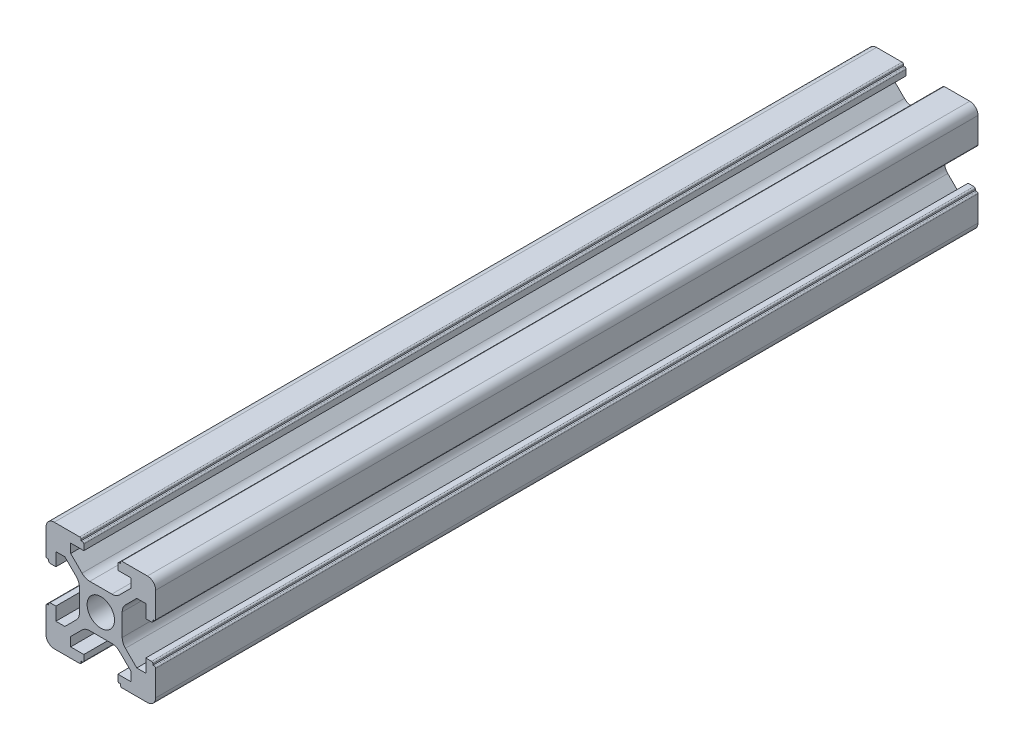
from build123d import *

# Parameters (mm, degrees)
SKETCH1_R           = 2.5
BOSS_EXTRUDE1_DEPTH = 150


with BuildPart() as part:
    # Sketch1 → Boss-Extrude1 (new body)
    with BuildSketch(Plane.XY):
        with BuildLine():
            Line((-8.5, 10), (-3.85, 10))
            ThreePointArc((-3.85, 10), (-3.673223305, 9.926776695), (-3.6, 9.75))
            Line((-3.6, 9.75), (-3.6, 9.5))
            Line((-3.6, 9.5), (-3.35, 9.5))
            ThreePointArc((-3.35, 9.5), (-3.173223305, 9.426776695), (-3.1, 9.25))
            Line((-3.1, 9.25), (-3.1, 8.2))
            Line((-3.1, 8.2), (-5.5, 8.2))
            Line((-5.5, 8.2), (-5.5, 6.560660172))
            Line((-5.5, 6.560660172), (-3.425126266, 4.485786438))
            ThreePointArc((-3.425126266, 4.485786438), (-2.776279568, 4.052240935), (-2.010912703, 3.9))
            Line((-2.010912703, 3.9), (2.010912703, 3.9))
            ThreePointArc((2.010912703, 3.9), (2.776279568, 4.052240935), (3.425126266, 4.485786438))
            Line((3.425126266, 4.485786438), (5.5, 6.560660172))
            Line((5.5, 6.560660172), (5.5, 8.2))
            Line((5.5, 8.2), (3.1, 8.2))
            Line((3.1, 8.2), (3.1, 9.25))
            ThreePointArc((3.1, 9.25), (3.173223305, 9.426776695), (3.35, 9.5))
            Line((3.35, 9.5), (3.6, 9.5))
            Line((3.6, 9.5), (3.6, 9.75))
            ThreePointArc((3.6, 9.75), (3.673223305, 9.926776695), (3.85, 10))
            Line((3.85, 10), (8.5, 10))
            ThreePointArc((8.5, 10), (9.560660172, 9.560660172), (10, 8.5))
            Line((10, 8.5), (10, 3.85))
            ThreePointArc((10, 3.85), (9.926776695, 3.673223305), (9.75, 3.6))
            Line((9.75, 3.6), (9.5, 3.6))
            Line((9.5, 3.6), (9.5, 3.35))
            ThreePointArc((9.5, 3.35), (9.426776695, 3.173223305), (9.25, 3.1))
            Line((9.25, 3.1), (8.2, 3.1))
            Line((8.2, 3.1), (8.2, 5.5))
            Line((8.2, 5.5), (6.560660172, 5.5))
            Line((6.560660172, 5.5), (4.485786438, 3.425126266))
            ThreePointArc((4.485786438, 3.425126266), (4.052240935, 2.776279568), (3.9, 2.010912703))
            Line((3.9, 2.010912703), (3.9, -2.010912703))
            ThreePointArc((3.9, -2.010912703), (4.052240935, -2.776279568), (4.485786438, -3.425126266))
            Line((4.485786438, -3.425126266), (6.560660172, -5.5))
            Line((6.560660172, -5.5), (8.2, -5.5))
            Line((8.2, -5.5), (8.2, -3.1))
            Line((8.2, -3.1), (9.25, -3.1))
            ThreePointArc((9.25, -3.1), (9.426776695, -3.173223305), (9.5, -3.35))
            Line((9.5, -3.35), (9.5, -3.6))
            Line((9.5, -3.6), (9.75, -3.6))
            ThreePointArc((9.75, -3.6), (9.926776695, -3.673223305), (10, -3.85))
            Line((10, -3.85), (10, -8.5))
            ThreePointArc((10, -8.5), (9.560660172, -9.560660172), (8.5, -10))
            Line((8.5, -10), (3.85, -10))
            ThreePointArc((3.85, -10), (3.673223305, -9.926776695), (3.6, -9.75))
            Line((3.6, -9.75), (3.6, -9.5))
            Line((3.6, -9.5), (3.35, -9.5))
            ThreePointArc((3.35, -9.5), (3.173223305, -9.426776695), (3.1, -9.25))
            Line((3.1, -9.25), (3.1, -8.2))
            Line((3.1, -8.2), (5.5, -8.2))
            Line((5.5, -8.2), (5.5, -6.560660172))
            Line((5.5, -6.560660172), (3.425126266, -4.485786438))
            ThreePointArc((3.425126266, -4.485786438), (2.776279568, -4.052240935), (2.010912703, -3.9))
            Line((2.010912703, -3.9), (-2.010912703, -3.9))
            ThreePointArc((-2.010912703, -3.9), (-2.776279568, -4.052240935), (-3.425126266, -4.485786438))
            Line((-3.425126266, -4.485786438), (-5.5, -6.560660172))
            Line((-5.5, -6.560660172), (-5.5, -8.2))
            Line((-5.5, -8.2), (-3.1, -8.2))
            Line((-3.1, -8.2), (-3.1, -9.25))
            ThreePointArc((-3.1, -9.25), (-3.173223305, -9.426776695), (-3.35, -9.5))
            Line((-3.35, -9.5), (-3.6, -9.5))
            Line((-3.6, -9.5), (-3.6, -9.75))
            ThreePointArc((-3.6, -9.75), (-3.673223305, -9.926776695), (-3.85, -10))
            Line((-3.85, -10), (-8.5, -10))
            ThreePointArc((-8.5, -10), (-9.560660172, -9.560660172), (-10, -8.5))
            Line((-10, -8.5), (-10, -3.85))
            ThreePointArc((-10, -3.85), (-9.926776695, -3.673223305), (-9.75, -3.6))
            Line((-9.75, -3.6), (-9.5, -3.6))
            Line((-9.5, -3.6), (-9.5, -3.35))
            ThreePointArc((-9.5, -3.35), (-9.426776695, -3.173223305), (-9.25, -3.1))
            Line((-9.25, -3.1), (-8.2, -3.1))
            Line((-8.2, -3.1), (-8.2, -5.5))
            Line((-8.2, -5.5), (-6.560660172, -5.5))
            Line((-6.560660172, -5.5), (-4.485786438, -3.425126266))
            ThreePointArc((-4.485786438, -3.425126266), (-4.052240935, -2.776279568), (-3.9, -2.010912703))
            Line((-3.9, -2.010912703), (-3.9, 2.010912703))
            ThreePointArc((-3.9, 2.010912703), (-4.052240935, 2.776279568), (-4.485786438, 3.425126266))
            Line((-4.485786438, 3.425126266), (-6.560660172, 5.5))
            Line((-6.560660172, 5.5), (-8.2, 5.5))
            Line((-8.2, 5.5), (-8.2, 3.1))
            Line((-8.2, 3.1), (-9.25, 3.1))
            ThreePointArc((-9.25, 3.1), (-9.426776695, 3.173223305), (-9.5, 3.35))
            Line((-9.5, 3.35), (-9.5, 3.6))
            Line((-9.5, 3.6), (-9.75, 3.6))
            ThreePointArc((-9.75, 3.6), (-9.926776695, 3.673223305), (-10, 3.85))
            Line((-10, 3.85), (-10, 8.5))
            ThreePointArc((-10, 8.5), (-9.560660172, 9.560660172), (-8.5, 10))
        make_face()
        Circle(SKETCH1_R, mode=Mode.SUBTRACT)
    extrude(amount=BOSS_EXTRUDE1_DEPTH)


solid = part.part
